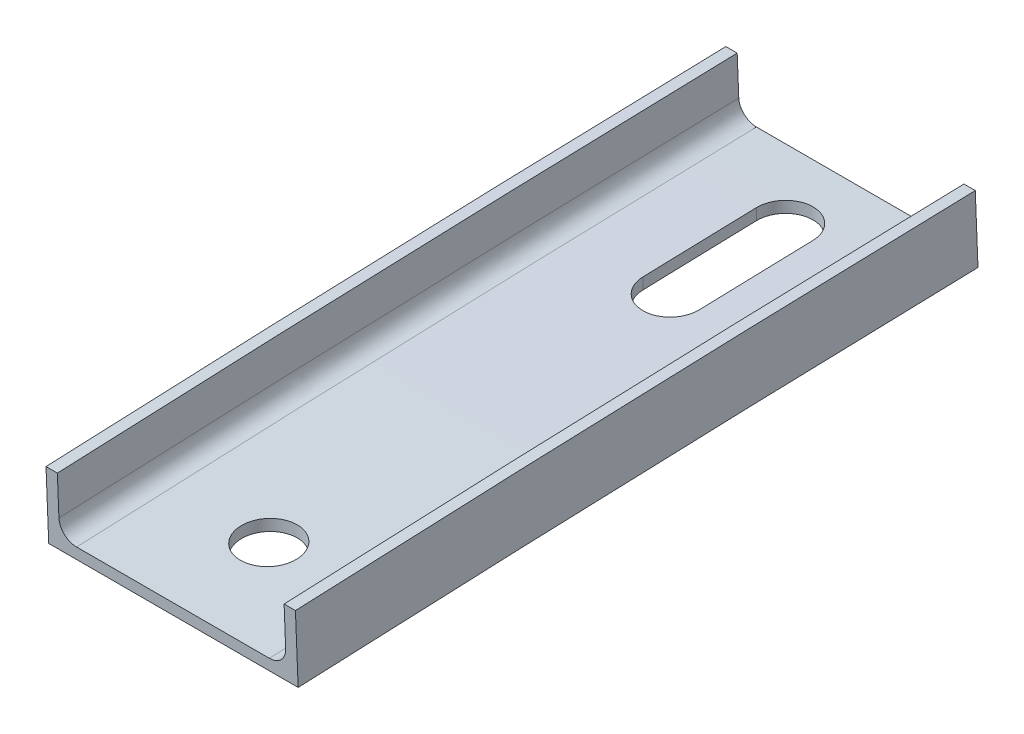
from build123d import *

# Parameters (mm, degrees)
VARIOUS_MOUNTING_POINTS_DEPTH      = 302.472328172
VARIOUS_MOUNTING_POINTS_DEPTH_BACK = 302.472328172
SKETCH4_R                          = 5
SKETCH5_W                          = 142.042704148
SKETCH5_H                          = 92.874075788
CUT_EXTRUDE1_DEPTH                 = 422.289527912


with BuildPart() as part:
    # Sweep1: sweep along a path in Sketch3
    with BuildLine(Plane(origin=(0, 0, 0), x_dir=(0, 0, -1), z_dir=(1, 0, 0))) as sweep1_path:
        ThreePointArc((-240, -6), (30, 0.074962051), (300, -6))
    # Sketch1 → Sweep1 (sweep)
    with BuildSketch(Plane.XY):
        with BuildLine():
            Line((-17, 0), (17, 0))
            ThreePointArc((17, 0), (19.121320344, 0.878679656), (20, 3))
            Line((20, 3), (20, 10))
            Line((20, 10), (22, 10))
            Line((22, 10), (22, -2))
            Line((22, -2), (-22, -2))
            Line((-22, -2), (-22, 10))
            Line((-22, 10), (-20, 10))
            Line((-20, 10), (-20, 3))
            ThreePointArc((-20, 3), (-19.121320344, 0.878679656), (-17, 0))
        make_face()
    sweep(path=sweep1_path.line)

    # Sketch4 → Various mounting points (cut, two sides: drawn at the far end of the back side and taken through both)
    with BuildSketch(Plane(origin=(0, 0, 0), x_dir=(1, 0, 0), z_dir=(0, 1, 0)).offset(-VARIOUS_MOUNTING_POINTS_DEPTH_BACK)):
        with Locations(Location((0, 197.900062461, 0), (0, 0, 270))):
            Circle(SKETCH4_R)
        with Locations(Location((0, -223.099937539, 0), (0, 0, 270))):
            Circle(SKETCH4_R)
        with BuildLine():
            Line((-5, 256.900062461), (-5, 276.900062461))
            ThreePointArc((-5, 276.900062461), (0, 281.900062461), (5, 276.900062461))
            Line((5, 276.900062461), (5, 256.900062461))
            ThreePointArc((5, 256.900062461), (0, 251.900062461), (-5, 256.900062461))
        make_face()
        with BuildLine():
            Line((-5, 87.900062461), (-5, 107.900062461))
            ThreePointArc((-5, 107.900062461), (0, 112.900062461), (5, 107.900062461))
            Line((5, 107.900062461), (5, 87.900062461))
            ThreePointArc((5, 87.900062461), (0, 82.900062461), (-5, 87.900062461))
        make_face()
        with BuildLine():
            Line((-5, 7.900062461), (-5, 27.900062461))
            ThreePointArc((-5, 27.900062461), (0, 32.900062461), (5, 27.900062461))
            Line((5, 27.900062461), (5, 7.900062461))
            ThreePointArc((5, 7.900062461), (0, 2.900062461), (-5, 7.900062461))
        make_face()
        with BuildLine():
            Line((-5, -72.099937539), (-5, -52.099937539))
            ThreePointArc((-5, -52.099937539), (0, -47.099937539), (5, -52.099937539))
            Line((5, -52.099937539), (5, -72.099937539))
            ThreePointArc((5, -72.099937539), (0, -77.099937539), (-5, -72.099937539))
        make_face()
        with BuildLine():
            Line((-5, -152.099937539), (-5, -132.099937539))
            ThreePointArc((-5, -132.099937539), (0, -127.099937539), (5, -132.099937539))
            Line((5, -132.099937539), (5, -152.099937539))
            ThreePointArc((5, -152.099937539), (0, -157.099937539), (-5, -152.099937539))
        make_face()
    extrude(amount=VARIOUS_MOUNTING_POINTS_DEPTH + VARIOUS_MOUNTING_POINTS_DEPTH_BACK, mode=Mode.SUBTRACT)

    # Sketch5 → Cut-Extrude1 (cut, through all)
    with BuildSketch(Plane(origin=(0, -4.799999233, 119.951980823), x_dir=(1, 0, 0), z_dir=(0, -0.039984006397440985, 0.9992003198720513))):
        with Locations((-10.646198733, -6.327716956)):
            Rectangle(SKETCH5_W, SKETCH5_H)
    extrude(amount=-CUT_EXTRUDE1_DEPTH, mode=Mode.SUBTRACT)


solid = part.part
